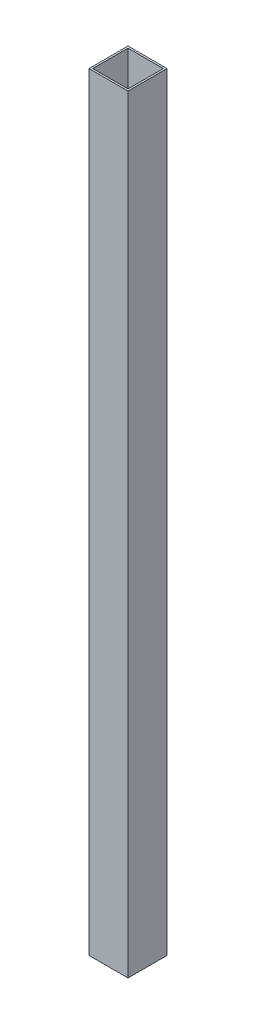
from build123d import *

# Parameters (mm, degrees)
SKETCH2_W           = 25.4
SKETCH2_H           = 25.4
SKETCH2_W_2         = 23
SKETCH2_H_2         = 23
BOSS_EXTRUDE1_DEPTH = 250


with BuildPart() as part:
    # Sketch2 → Boss-Extrude1 (new, symmetric)
    with BuildSketch(Plane(origin=(0, 0, 0), x_dir=(1, 0, 0), z_dir=(0, 1, 0))):
        Rectangle(SKETCH2_W, SKETCH2_H)
        Rectangle(SKETCH2_W_2, SKETCH2_H_2, mode=Mode.SUBTRACT)
    extrude(amount=BOSS_EXTRUDE1_DEPTH, both=True)


solid = part.part
